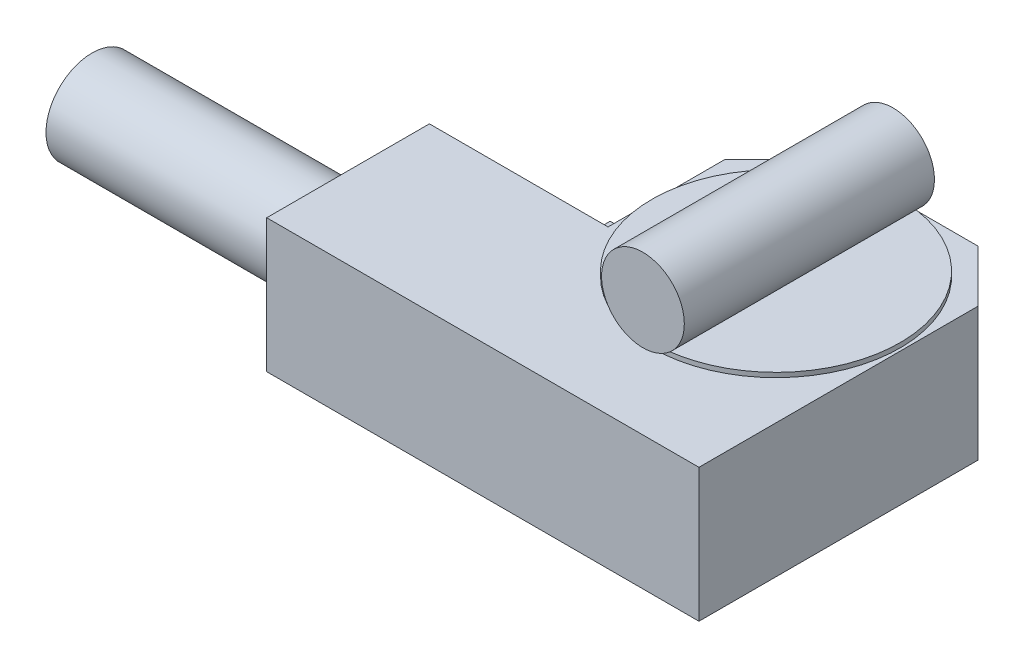
from build123d import *
from build123d.topology import SkipClean

# Parameters (mm, degrees)
BOSS_EXTRUDE1_DEPTH = 14.5
SKETCH2_W           = 12.422845353
SKETCH2_H           = 12.651384387
CUT_EXTRUDE1_DEPTH  = 12
SKETCH3_R           = 1.1
CUT_EXTRUDE2_DEPTH  = 61.406953242
SKETCH4_R           = 5
BOSS_EXTRUDE2_DEPTH = 27
SKETCH5_R           = 13.5
BOSS_EXTRUDE3_DEPTH = 0.5
SKETCH6_W           = 9
SKETCH6_H           = 27.198164612
BOSS_EXTRUDE4_DEPTH = 9
CUT_EXTRUDE3_DEPTH  = 60.880218146


with BuildPart() as part:
    # Sketch1 → Boss-Extrude1 (new body)
    with BuildSketch(Plane(origin=(0, 0, 0), x_dir=(1, 0, 0), z_dir=(0, 1, 0))):
        Polygon((0, 0), (47, 0), (47, 30.343145751), (41.343145751, 36), (25.068998023, 36), (19.412143774, 30.343145751), (7, 30.343145751), (7, 17.691761364), (0, 17.691761364), align=None)
    extrude(amount=BOSS_EXTRUDE1_DEPTH)

    # Sketch2 → Cut-Extrude1 (cut)
    with BuildSketch(Plane(origin=(0, 14.5, 0), x_dir=(1, 0, 0), z_dir=(0, 1, 0))):
        with Locations((13.211422676, 24.017453558)):
            Rectangle(SKETCH2_W, SKETCH2_H)
    extrude(amount=-CUT_EXTRUDE1_DEPTH, mode=Mode.SUBTRACT)

    # Sketch3 → Cut-Extrude2 (cut, through all)
    with BuildSketch(Plane(origin=(0, 2.5, 0), x_dir=(1, 0, 0), z_dir=(0, 1, 0))):
        with Locations(Location((10.211422676, 27.017453557, 0), (0, 0, 270))):
            Circle(SKETCH3_R)
        with Locations(Location((16.149341191, 27.017453557, 0), (0, 0, 270))):
            Circle(SKETCH3_R)
        with Locations(Location((10.211422676, 20.965083317, 0), (0, 0, 270))):
            Circle(SKETCH3_R)
        with Locations(Location((16.149341191, 21.025487114, 0), (0, 0, 270))):
            Circle(SKETCH3_R)
    extrude(amount=-CUT_EXTRUDE2_DEPTH, mode=Mode.SUBTRACT)

    # Sketch4 → Boss-Extrude2 (add)
    with BuildSketch(Plane.ZY):
        with Locations(Location((-8, 7.514999755, 0), (0, 0, 180))):
            Circle(SKETCH4_R)
    extrude(amount=BOSS_EXTRUDE2_DEPTH)

    # Sketch5 → Boss-Extrude3 (add)
    with BuildSketch(Plane(origin=(0, 14.5, 0), x_dir=(1, 0, 0), z_dir=(0, 1, 0))):
        with Locations(Location((33.204612806, 22.174650575, 0), (0, 0, 270))):
            Circle(SKETCH5_R)
    extrude(amount=BOSS_EXTRUDE3_DEPTH)

    # Sketch6 → Boss-Extrude4 (add)
    with BuildSketch(Plane(origin=(0, 15, 0), x_dir=(1, 0, 0), z_dir=(0, 1, 0))):
        with Locations((33.204612806, 21.303490331)):
            Rectangle(SKETCH6_W, SKETCH6_H)
    extrude(amount=BOSS_EXTRUDE4_DEPTH)

    # Sketch7 → Cut-Extrude3 (cut, through all)
    with SkipClean():  # the faces are left unmerged after this step: merging them gives an invalid solid
        with BuildSketch(Plane.XY.offset(-7.704408025)):
            with BuildLine():
                Line((33.204612806, 24), (28.704612806, 24))
                Line((28.704612806, 24), (28.704612806, 19.5))
                ThreePointArc((28.704612806, 19.5), (30.022632291, 22.681980515), (33.204612806, 24))
            make_face()
            with BuildLine():
                Line((37.704612806, 24), (33.204612806, 24))
                ThreePointArc((33.204612806, 24), (36.386593321, 22.681980515), (37.704612806, 19.5))
                Line((37.704612806, 19.5), (37.704612806, 24))
            make_face()
            with BuildLine():
                Line((37.704612806, 15), (37.704612806, 19.5))
                ThreePointArc((37.704612806, 19.5), (36.386593321, 16.318019485), (33.204612806, 15))
                Line((33.204612806, 15), (37.704612806, 15))
            make_face()
            with BuildLine():
                ThreePointArc((33.204612806, 15), (30.022632291, 16.318019485), (28.704612806, 19.5))
                Line((28.704612806, 19.5), (28.704612806, 15))
                Line((28.704612806, 15), (33.204612806, 15))
            make_face()
        extrude(amount=-CUT_EXTRUDE3_DEPTH, mode=Mode.SUBTRACT)


with BuildPart() as cut_extrude3_piece_1:
    # of the separate pieces the step leaves, piece 1, a body of its own (cut_extrude3_pieces)
    add(part.part.solids().sort_by_distance((0, 0, 0))[0])


with BuildPart() as cut_extrude3_piece_2:
    # of the separate pieces the step leaves, piece 2, a body of its own (cut_extrude3_pieces)
    add(part.part.solids().sort_by_distance((37.704612806, 19.5, -7.704408025))[0])


solid = Compound([cut_extrude3_piece_1.part, cut_extrude3_piece_2.part])
